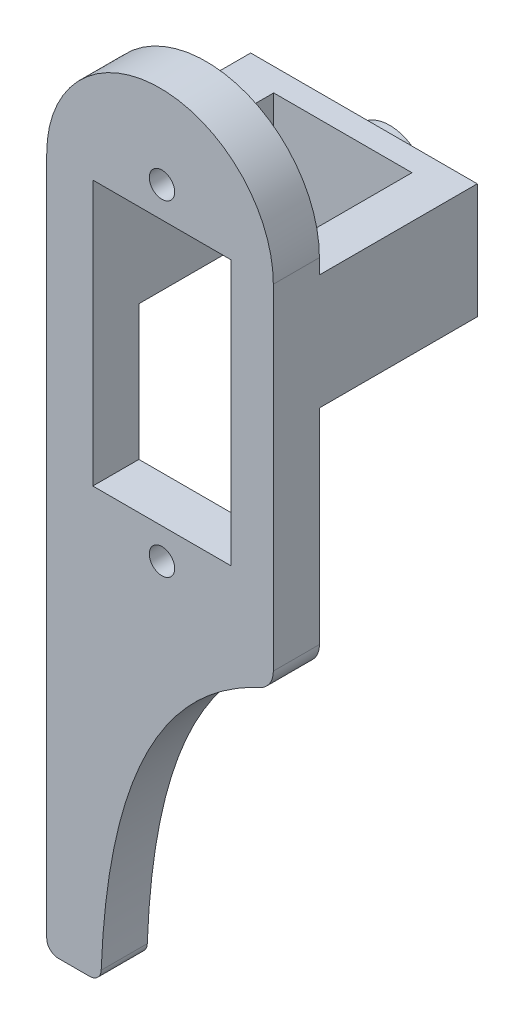
from build123d import *

# Parameters (mm, degrees)
BOSS_EXTRUDE1_DEPTH = 4
CUT_EXTRUDE1_REACH  = 67.872
SKETCH2_R           = 1.1
SKETCH2_W           = 12
SKETCH2_H           = 23
FILLET1_R           = 2
FILLET2_R           = 1
FILLET3_R           = 1
SKETCH3_W           = 3.666320095
SKETCH3_H           = 10
SKETCH3_W_2         = 4
BOSS_EXTRUDE2_DEPTH = 11.7
SKETCH4_W           = 19.666320095
SKETCH4_H           = 10
BOSS_EXTRUDE3_DEPTH = 2
SKETCH5_R           = 3.4
BOSS_EXTRUDE4_DEPTH = 2


with BuildPart() as part:
    # Sketch1 → Boss-Extrude1 (new body)
    with BuildSketch(Plane.XY):
        with BuildLine():
            Line((10.219576084, 1.434709353), (10.219576084, -58.565290647))
            Line((10.219576084, -58.565290647), (14.921299434, -58.565290647))
            Line((14.921299434, -58.565290647), (14.921299434, -58.307205095))
            add(Edge.make_bspline(
                [(29.885896179, -28.969975988), (15.603913992, -34.528623974), (14.921299434, -58.307205095)],
                knots=[0, 0, 0, 1, 1, 1], degree=2))
            Line((29.885896179, -28.969975988), (29.885896179, 1.434709353))
            ThreePointArc((29.885896179, 1.434709353), (20.052736131, 11.2678694), (10.219576084, 1.434709353))
        make_face()
    extrude(amount=BOSS_EXTRUDE1_DEPTH)

    # Sketch2 → Cut-Extrude1 (cut, up to next)
    with BuildSketch(Plane.XY.offset(4), mode=Mode.PRIVATE) as cut_extrude1_sk1:
        with Locations((20.219576084, 4.084709353)):
            Circle(SKETCH2_R)
    cut_extrude1_tool1 = extrude(cut_extrude1_sk1.sketch, amount=-CUT_EXTRUDE1_REACH, mode=Mode.PRIVATE) & part.part
    # Sketch2 → Cut-Extrude1 (cut, up to next)
    with BuildSketch(Plane.XY.offset(4), mode=Mode.PRIVATE) as cut_extrude1_sk2:
        with Locations((20.219576084, -24.215290647)):
            Circle(SKETCH2_R)
    cut_extrude1_tool2 = extrude(cut_extrude1_sk2.sketch, amount=-CUT_EXTRUDE1_REACH, mode=Mode.PRIVATE) & part.part
    # Sketch2 → Cut-Extrude1 (cut, up to next)
    with BuildSketch(Plane.XY.offset(4), mode=Mode.PRIVATE) as cut_extrude1_sk3:
        with Locations((20.219576084, -10.065290647)):
            Rectangle(SKETCH2_W, SKETCH2_H)
    cut_extrude1_tool3 = extrude(cut_extrude1_sk3.sketch, amount=-CUT_EXTRUDE1_REACH, mode=Mode.PRIVATE) & part.part
    add(cut_extrude1_tool1.solids().sort_by_distance((20.219576, 4.084709, 4))[0], mode=Mode.SUBTRACT)
    add(cut_extrude1_tool2.solids().sort_by_distance((20.219576, -24.215291, 4))[0], mode=Mode.SUBTRACT)
    add(cut_extrude1_tool3.solids().sort_by_distance((20.219576, -10.065291, 4))[0], mode=Mode.SUBTRACT)

    # Fillet1
    fillet1_edges = [part.edges().sort_by_distance(p)[0] for p in [
        (29.885896179, -28.969975988, 2),
    ]]
    fillet(fillet1_edges, radius=FILLET1_R)

    # Fillet2
    fillet2_edges = [part.edges().sort_by_distance(p)[0] for p in [
        (14.921299434, -58.565290647, 2),
    ]]
    fillet(fillet2_edges, radius=FILLET2_R)

    # Fillet3
    fillet3_edges = [part.edges().sort_by_distance(p)[0] for p in [
        (10.219576084, -58.565290647, 2),
    ]]
    fillet(fillet3_edges, radius=FILLET3_R)

    # Sketch3 → Boss-Extrude2 (add)
    with BuildSketch(Plane(origin=(0, 0, 0), x_dir=(-1, 0, 0), z_dir=(0, 0, -1))):
        with Locations((-28.052736132, -4.865290647)):
            Rectangle(SKETCH3_W, SKETCH3_H)
        with Locations((-12.219576084, -4.865290647)):
            Rectangle(SKETCH3_W_2, SKETCH3_H)
    extrude(amount=BOSS_EXTRUDE2_DEPTH)

    # Sketch4 → Boss-Extrude3 (add)
    with BuildSketch(Plane(origin=(0, 0, -11.7), x_dir=(-1, 0, 0), z_dir=(0, 0, -1))):
        with Locations((-20.052736132, -4.865290647)):
            Rectangle(SKETCH4_W, SKETCH4_H)
    extrude(amount=BOSS_EXTRUDE3_DEPTH)

    # Sketch5 → Boss-Extrude4 (add)
    with BuildSketch(Plane(origin=(0, 0, -13.7), x_dir=(-1, 0, 0), z_dir=(0, 0, -1))):
        with Locations((-20.285896179, -4.665290647)):
            Circle(SKETCH5_R)
    extrude(amount=BOSS_EXTRUDE4_DEPTH)


solid = part.part
